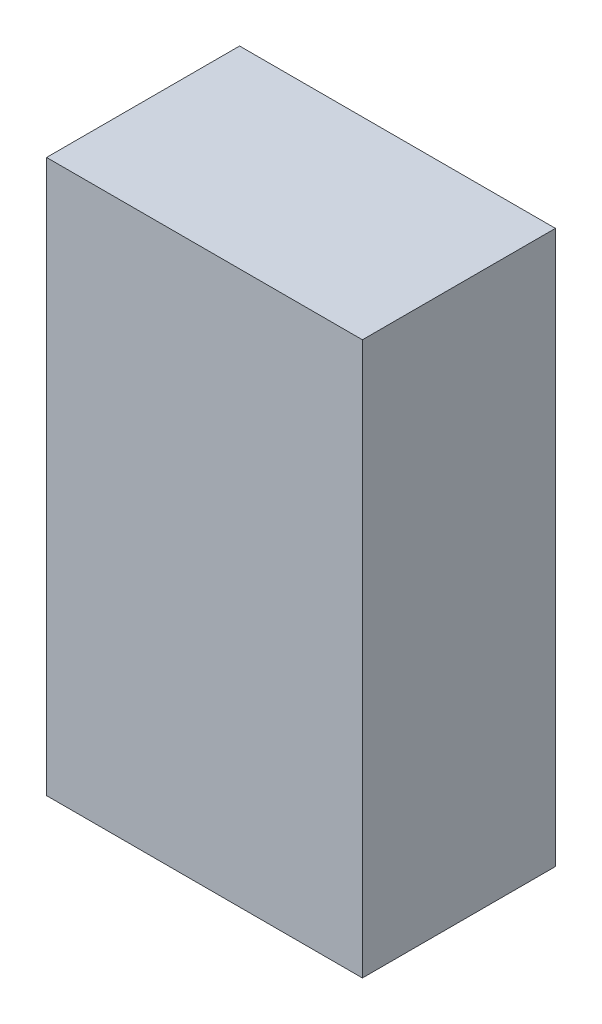
from build123d import *

# Parameters (mm, degrees)
SKETCH1_W         = 36
SKETCH1_H         = 63
SKETCH1_W_2       = 32
SKETCH1_H_2       = 59
WALL_HEIGHT_DEPTH = 20
ROOF_START        = 20
SKETCH1_3_W       = 36
SKETCH1_3_H       = 63
SKETCH1_3_W_2     = 32
SKETCH1_3_H_2     = 59
ROOF_DEPTH        = 2


with BuildPart() as part:
    # Sketch1 → Wall_Height (new body)
    with BuildSketch(Plane.XY):
        with Locations((18, -31.5)):
            Rectangle(SKETCH1_W, SKETCH1_H)
        with Locations((18, -31.5)):
            Rectangle(SKETCH1_W_2, SKETCH1_H_2, mode=Mode.SUBTRACT)
    extrude(amount=WALL_HEIGHT_DEPTH)

    # Sketch1<3> → Roof (add)
    # profile 1 of 2: a face of its own
    with BuildSketch(Plane.XY.offset(ROOF_START)):
        with Locations((18, -31.5)):
            Rectangle(SKETCH1_3_W, SKETCH1_3_H)
        with Locations((18, -31.5)):
            Rectangle(SKETCH1_3_W_2, SKETCH1_3_H_2, mode=Mode.SUBTRACT)
    # profile 2 of 2: a face of its own
    with BuildSketch(Plane.XY.offset(ROOF_START)):
        with Locations((18, -31.5)):
            Rectangle(SKETCH1_3_W_2, SKETCH1_3_H_2)
    extrude(amount=ROOF_DEPTH)


solid = part.part
